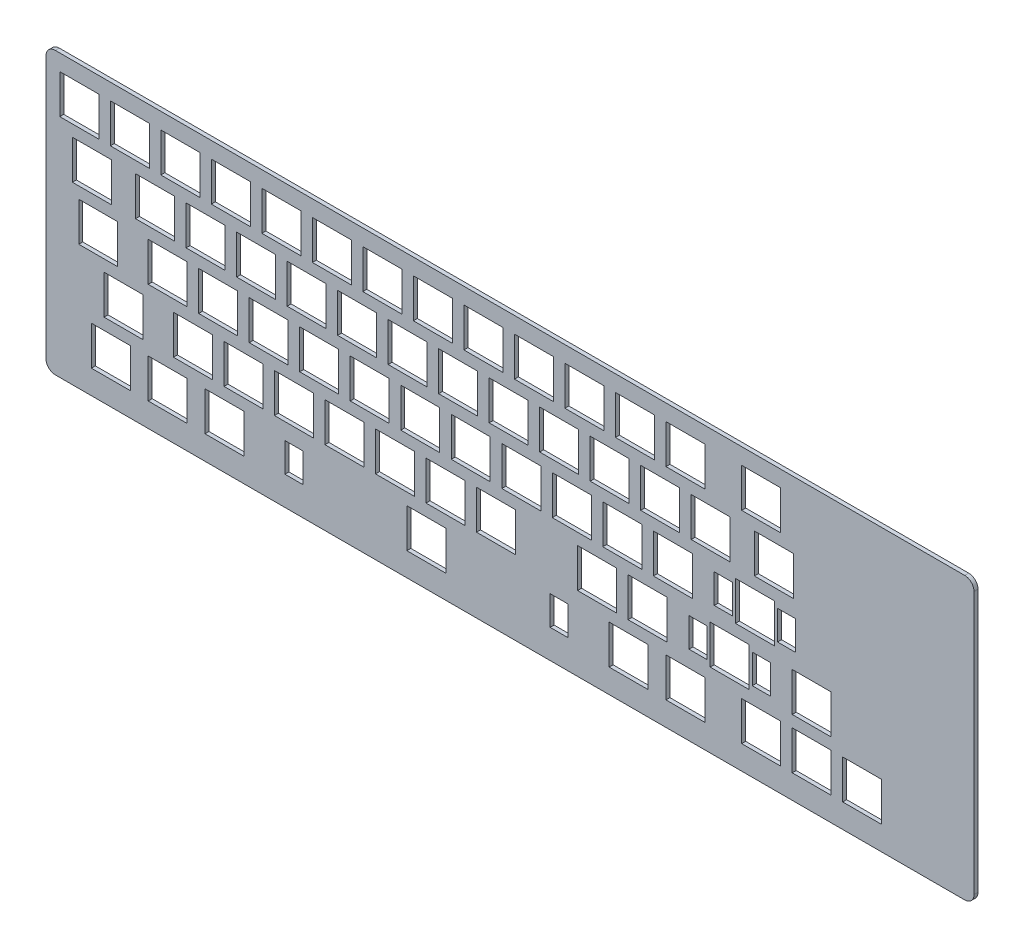
from build123d import *

# Parameters (mm, degrees)
BOSS_EXTRUDE1_DEPTH = 1.5
KEYHOLES_W          = 14.69983419
KEYHOLES_H          = 14.700290435
KEYHOLES_W_2        = 6.8
KEYHOLES_H_2        = 11
CUT_EXTRUDE2_DEPTH  = 3.6


with BuildPart() as part:
    # plate → Boss-Extrude1 (new body)
    with BuildSketch(Plane.XY.offset(5.092519685)):
        with BuildLine():
            Line((33.52, -25.21), (376.52, -25.21))
            ThreePointArc((376.52, -25.21), (378.994873734, -26.235126266), (380.02, -28.71))
            Line((380.02, -28.71), (380.02, -127.71))
            ThreePointArc((380.02, -127.71), (378.994873734, -130.184873734), (376.52, -131.21))
            Line((376.52, -131.21), (33.52, -131.21))
            ThreePointArc((33.52, -131.21), (31.045126266, -130.184873734), (30.02, -127.71))
            Line((30.02, -127.71), (30.02, -28.71))
            ThreePointArc((30.02, -28.71), (31.045126266, -26.235126266), (33.52, -25.21))
        make_face()
    extrude(amount=-BOSS_EXTRUDE1_DEPTH)

    # keyholes → Cut-Extrude2 (cut)
    with BuildSketch(Plane.XY.offset(5.092519685)):
        with Locations((42.577901806, -38.662141019)):
            Rectangle(KEYHOLES_W, KEYHOLES_H)
        with Locations((61.627901806, -38.662141019)):
            Rectangle(KEYHOLES_W, KEYHOLES_H)
        with Locations((80.677901806, -38.662141019)):
            Rectangle(KEYHOLES_W, KEYHOLES_H)
        with Locations((99.727901806, -38.662141019)):
            Rectangle(KEYHOLES_W, KEYHOLES_H)
        with Locations((118.777901806, -38.662141019)):
            Rectangle(KEYHOLES_W, KEYHOLES_H)
        with Locations((137.827901806, -38.662141019)):
            Rectangle(KEYHOLES_W, KEYHOLES_H)
        with Locations((156.877901806, -38.662141019)):
            Rectangle(KEYHOLES_W, KEYHOLES_H)
        with Locations((175.927901806, -38.662141019)):
            Rectangle(KEYHOLES_W, KEYHOLES_H)
        with Locations((194.977901806, -38.662141019)):
            Rectangle(KEYHOLES_W, KEYHOLES_H)
        with Locations((214.027901806, -38.662141019)):
            Rectangle(KEYHOLES_W, KEYHOLES_H)
        with Locations((233.077901806, -38.662141019)):
            Rectangle(KEYHOLES_W, KEYHOLES_H)
        with Locations((252.127901806, -38.662141019)):
            Rectangle(KEYHOLES_W, KEYHOLES_H)
        with Locations((299.752901806, -38.662141019)):
            Rectangle(KEYHOLES_W, KEYHOLES_H)
        with Locations((47.340401806, -57.712141019)):
            Rectangle(KEYHOLES_W, KEYHOLES_H)
        with Locations((71.152901806, -57.712141019)):
            Rectangle(KEYHOLES_W, KEYHOLES_H)
        with Locations((90.202901806, -57.712141019)):
            Rectangle(KEYHOLES_W, KEYHOLES_H)
        with Locations((109.252901806, -57.712141019)):
            Rectangle(KEYHOLES_W, KEYHOLES_H)
        with Locations((147.352901806, -57.712141019)):
            Rectangle(KEYHOLES_W, KEYHOLES_H)
        with Locations((166.402901806, -57.712141019)):
            Rectangle(KEYHOLES_W, KEYHOLES_H)
        with Locations((185.452901806, -57.712141019)):
            Rectangle(KEYHOLES_W, KEYHOLES_H)
        with Locations((114.015401806, -76.762141019)):
            Rectangle(KEYHOLES_W, KEYHOLES_H)
        with Locations((133.065401806, -76.762141019)):
            Rectangle(KEYHOLES_W, KEYHOLES_H)
        with Locations((152.115401806, -76.762141019)):
            Rectangle(KEYHOLES_W, KEYHOLES_H)
        with Locations((171.165401806, -76.762141019)):
            Rectangle(KEYHOLES_W, KEYHOLES_H)
        with Locations((190.215401806, -76.762141019)):
            Rectangle(KEYHOLES_W, KEYHOLES_H)
        with Locations((49.721651806, -76.762141019)):
            Rectangle(KEYHOLES_W, KEYHOLES_H)
        with Locations((75.915401806, -76.762141019)):
            Rectangle(KEYHOLES_W, KEYHOLES_H)
        with Locations((94.965401806, -76.762141019)):
            Rectangle(KEYHOLES_W, KEYHOLES_H)
        with Locations((204.502901806, -57.712141019)):
            Rectangle(KEYHOLES_W, KEYHOLES_H)
        with Locations((209.265401806, -76.762141019)):
            Rectangle(KEYHOLES_W, KEYHOLES_H)
        with Locations((223.552901806, -57.712141019)):
            Rectangle(KEYHOLES_W, KEYHOLES_H)
        with Locations((228.315401806, -76.762141019)):
            Rectangle(KEYHOLES_W, KEYHOLES_H)
        with Locations((242.602901806, -57.712141019)):
            Rectangle(KEYHOLES_W, KEYHOLES_H)
        with Locations((261.652901806, -57.712141019)):
            Rectangle(KEYHOLES_W, KEYHOLES_H)
        with Locations((247.365401806, -76.762141019)):
            Rectangle(KEYHOLES_W, KEYHOLES_H)
        with Locations((266.415401806, -76.762141019)):
            Rectangle(KEYHOLES_W, KEYHOLES_H)
        with Locations((280.702901806, -57.712141019)):
            Rectangle(KEYHOLES_W, KEYHOLES_H)
        with Locations((304.515401806, -57.712141019)):
            Rectangle(KEYHOLES_W, KEYHOLES_H)
        with Locations((297.371651806, -76.762141019)):
            Rectangle(KEYHOLES_W, KEYHOLES_H)
        with Locations((285.43875, -76.755)):
            Rectangle(KEYHOLES_W_2, KEYHOLES_H_2)
        with Locations((309.31875, -76.755)):
            Rectangle(KEYHOLES_W_2, KEYHOLES_H_2)
        with Locations((337.852901806, -114.862141019)):
            Rectangle(KEYHOLES_W, KEYHOLES_H)
        with Locations((318.802901806, -114.862141019)):
            Rectangle(KEYHOLES_W, KEYHOLES_H)
        with Locations((299.752901806, -114.862141019)):
            Rectangle(KEYHOLES_W, KEYHOLES_H)
        with Locations((318.802901806, -95.812141019)):
            Rectangle(KEYHOLES_W, KEYHOLES_H)
        with Locations((287.846651806, -95.812141019)):
            Rectangle(KEYHOLES_W, KEYHOLES_H)
        with Locations((299.79375, -95.805)):
            Rectangle(KEYHOLES_W_2, KEYHOLES_H_2)
        with Locations((275.91375, -95.805)):
            Rectangle(KEYHOLES_W_2, KEYHOLES_H_2)
        with Locations((271.177901806, -114.862141019)):
            Rectangle(KEYHOLES_W, KEYHOLES_H)
        with Locations((249.746651806, -114.862141019)):
            Rectangle(KEYHOLES_W, KEYHOLES_H)
        with Locations((256.890401806, -95.812141019)):
            Rectangle(KEYHOLES_W, KEYHOLES_H)
        with Locations((237.840401806, -95.812141019)):
            Rectangle(KEYHOLES_W, KEYHOLES_H)
        with Locations((223.55375, -114.855)):
            Rectangle(KEYHOLES_W_2, KEYHOLES_H_2)
        with Locations((199.740401806, -95.812141019)):
            Rectangle(KEYHOLES_W, KEYHOLES_H)
        with Locations((173.446651806, -114.987141019)):
            Rectangle(KEYHOLES_W, KEYHOLES_H)
        with Locations((180.690401806, -95.812141019)):
            Rectangle(KEYHOLES_W, KEYHOLES_H)
        with Locations((161.640401806, -95.812141019)):
            Rectangle(KEYHOLES_W, KEYHOLES_H)
        with Locations((123.55375, -114.855)):
            Rectangle(KEYHOLES_W_2, KEYHOLES_H_2)
        with Locations((142.590401806, -95.812141019)):
            Rectangle(KEYHOLES_W, KEYHOLES_H)
        with Locations((123.540401806, -95.812141019)):
            Rectangle(KEYHOLES_W, KEYHOLES_H)
        with Locations((104.490401806, -95.812141019)):
            Rectangle(KEYHOLES_W, KEYHOLES_H)
        with Locations((97.346651806, -114.862141019)):
            Rectangle(KEYHOLES_W, KEYHOLES_H)
        with Locations((85.440401806, -95.812141019)):
            Rectangle(KEYHOLES_W, KEYHOLES_H)
        with Locations((75.915401806, -114.862141019)):
            Rectangle(KEYHOLES_W, KEYHOLES_H)
        with Locations((54.484151806, -114.862141019)):
            Rectangle(KEYHOLES_W, KEYHOLES_H)
        with Locations((59.246651806, -95.812141019)):
            Rectangle(KEYHOLES_W, KEYHOLES_H)
        with Locations((271.177901806, -38.662141019)):
            Rectangle(KEYHOLES_W, KEYHOLES_H)
        with Locations((128.302901806, -57.712141019)):
            Rectangle(KEYHOLES_W, KEYHOLES_H)
    extrude(amount=-CUT_EXTRUDE2_DEPTH, mode=Mode.SUBTRACT)


solid = part.part
